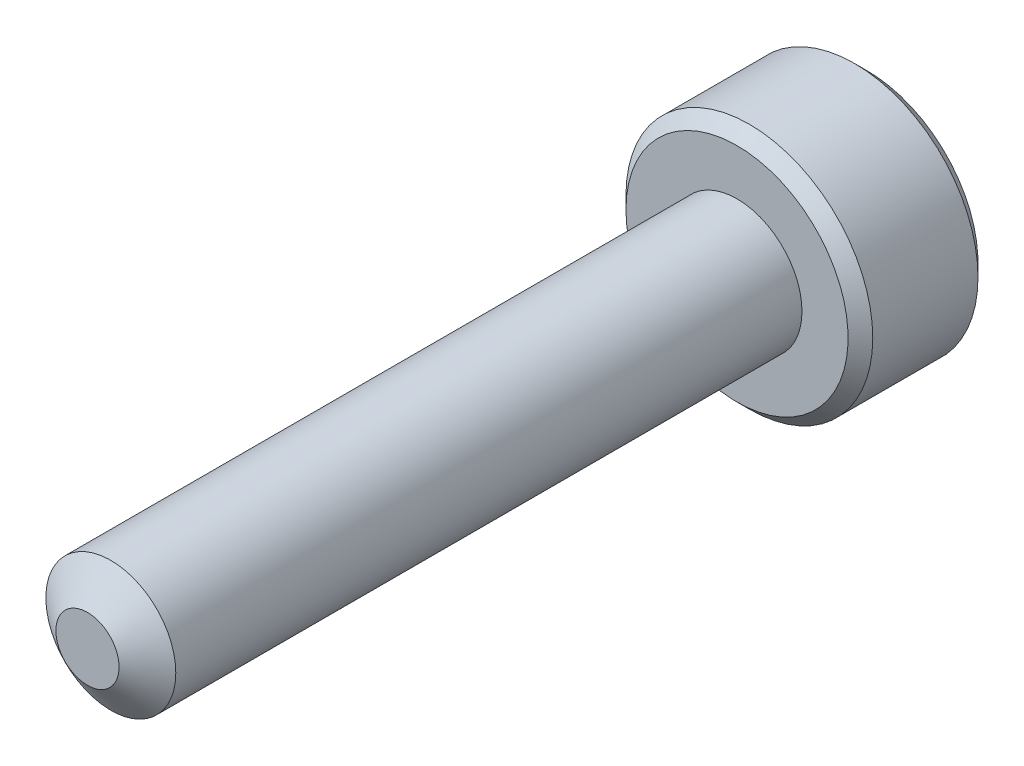
from build123d import *

# Parameters (mm, degrees)
SKETCH1_R          = 1
EXTRUDE1_DEPTH     = 10
SKETCH6_R          = 1.9
EXTRUDE2_DEPTH     = 2
CUT_EXTRUDE1_DEPTH = 1.125
CHAMFER1_SIZE      = 0.19


with BuildPart() as part:
    # Sketch1 → Extrude1 (new body)
    with BuildSketch(Plane.XY):
        Circle(SKETCH1_R)
    extrude(amount=-EXTRUDE1_DEPTH)

    # Sketch4 → Cut-Revolve1 (revolve, cut)
    with BuildSketch(Plane(origin=(0, 0, 0), x_dir=(0, 0, -1), z_dir=(1, 0, 0))):
        Polygon((0.35977197, 1), (0, 0.486192379), (0, 1), align=None)
    revolve(axis=Axis((0, 0, 0), (0, 0, -1)), mode=Mode.SUBTRACT)

    # Sketch6 → Extrude2 (add)
    with BuildSketch(Plane(origin=(0, 0, -10), x_dir=(-1, 0, 0), z_dir=(0, 0, -1))):
        Circle(SKETCH6_R)
    extrude(amount=EXTRUDE2_DEPTH)

    # Sketch7 → Cut-Extrude1 (cut)
    with BuildSketch(Plane(origin=(0, 0, -12), x_dir=(-1, 0, 0), z_dir=(0, 0, -1))):
        Polygon((0, 0.866025404), (-0.75, 0.433012702), (-0.75, -0.433012702), (0, -0.866025404), (0.75, -0.433012702), (0.75, 0.433012702), align=None)
    extrude(amount=-CUT_EXTRUDE1_DEPTH, mode=Mode.SUBTRACT)

    # Cut-Extrude2 cone 1 section (through the dimple's axis) → Cut-Extrude2 (revolve, cut)
    with BuildSketch(Plane(origin=(0, 0, -12), x_dir=(0, 1, 0), z_dir=(1, 0, 0))):
        Polygon((0, 0), (0.866025404, 0), (0, 0.866025404), align=None)
    revolve(axis=Axis((0, 0, -12), (0, 0, 1)), mode=Mode.SUBTRACT)

    # Chamfer1
    chamfer1_edges = [part.edges().sort_by_distance(p)[0] for p in [
        (1.9, 0, -12),
        (1.9, 0, -10),
    ]]
    chamfer(chamfer1_edges, length=CHAMFER1_SIZE)


solid = part.part
